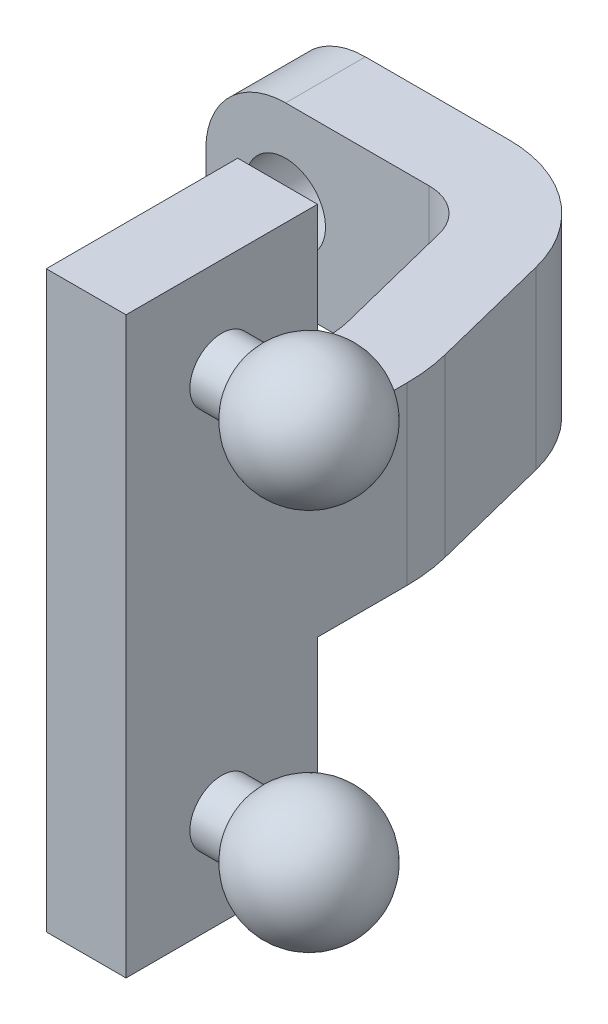
from build123d import *

# Parameters (mm, degrees)
EXTRUDE_1_DEPTH     = 2.75
SKETCH_2_R          = 1.25
CUT_EXTRUDE_1_DEPTH = 10
FILLET_2_R          = 2.5
SKETCH_4_W          = 6
SKETCH_4_H          = 18
EXTRUDE_2_DEPTH     = 2.5
SKETCH_5_R          = 1
EXTRUDE_3_DEPTH     = 1


with BuildPart() as part:
    # 草图1 → 凸台-拉伸1 (new, symmetric)
    with BuildSketch(Plane(origin=(0, 0, 0), x_dir=(1, 0, 0), z_dir=(0, 1, 0))):
        with BuildLine():
            Line((0, 0), (7, 0))
            ThreePointArc((7, 0), (9.461409331, -0.846991262), (10.880422565, -3.029267947))
            Line((10.880422565, -3.029267947), (11.831813783, -6.832377099))
            ThreePointArc((11.831813783, -6.832377099), (11.957795141, -7.509886755), (12, -8.197716229))
            Line((12, -8.197716229), (12, -17))
            Line((12, -17), (9.5, -17))
            Line((9.5, -17), (9.5, -8.197716229))
            ThreePointArc((9.5, -8.197716229), (9.47654946, -7.815533399), (9.40654968, -7.439084632))
            Line((9.40654968, -7.439084632), (8.455158462, -3.63597548))
            ThreePointArc((8.455158462, -3.63597548), (7.923028499, -2.817621723), (7, -2.5))
            Line((7, -2.5), (0, -2.5))
            Line((0, -2.5), (0, 0))
        make_face()
    extrude(amount=EXTRUDE_1_DEPTH, both=True)

    # 草图2 → 切除-拉伸1 (cut)
    with BuildSketch(Plane(origin=(0, 0, 0), x_dir=(-1, 0, 0), z_dir=(0, 0, -1))):
        with Locations((-2.5, 0)):
            Circle(SKETCH_2_R)
    extrude(amount=-CUT_EXTRUDE_1_DEPTH, mode=Mode.SUBTRACT)

    # 圆角2
    fillet_2_edges = [part.edges().sort_by_distance(p)[0] for p in [
        (0, -2.75, 1.25),
        (0, 2.75, 1.25),
    ]]
    fillet(fillet_2_edges, radius=FILLET_2_R)

    # 草图4 → 凸台-拉伸2 (add)
    with BuildSketch(Plane.ZY.offset(-9.5)):
        with Locations((14, 0)):
            Rectangle(SKETCH_4_W, SKETCH_4_H)
    extrude(amount=-EXTRUDE_2_DEPTH)

    # 草图5 → 凸台-拉伸3 (add)
    with BuildSketch(Plane(origin=(12, 0, 0), x_dir=(0, 0, -1), z_dir=(1, 0, 0))):
        with Locations(Location((-14, 6, 0), (0, 0, 180))):
            Circle(SKETCH_5_R)
    extrude_3 = extrude(amount=EXTRUDE_3_DEPTH)

    # 草图6 → 旋转1 (revolve)
    with BuildSketch(Plane(origin=(0, 0, 14), x_dir=(-1, 0, 0), z_dir=(0, 0, -1))):
        with BuildLine():
            Line((-13, 6), (-16.732050808, 6))
            ThreePointArc((-16.732050808, 6), (-15.249688898, 7.931851653), (-13, 7))
            Line((-13, 7), (-13, 6))
        make_face()
    revolve_1 = revolve(axis=Axis((13, 6, 14), (1, 0, 0)))

    # 镜向1: 凸台-拉伸3, 旋转1 across plane
    add(extrude_3.mirror(Plane.ZX))
    add(revolve_1.mirror(Plane.ZX))


solid = part.part
